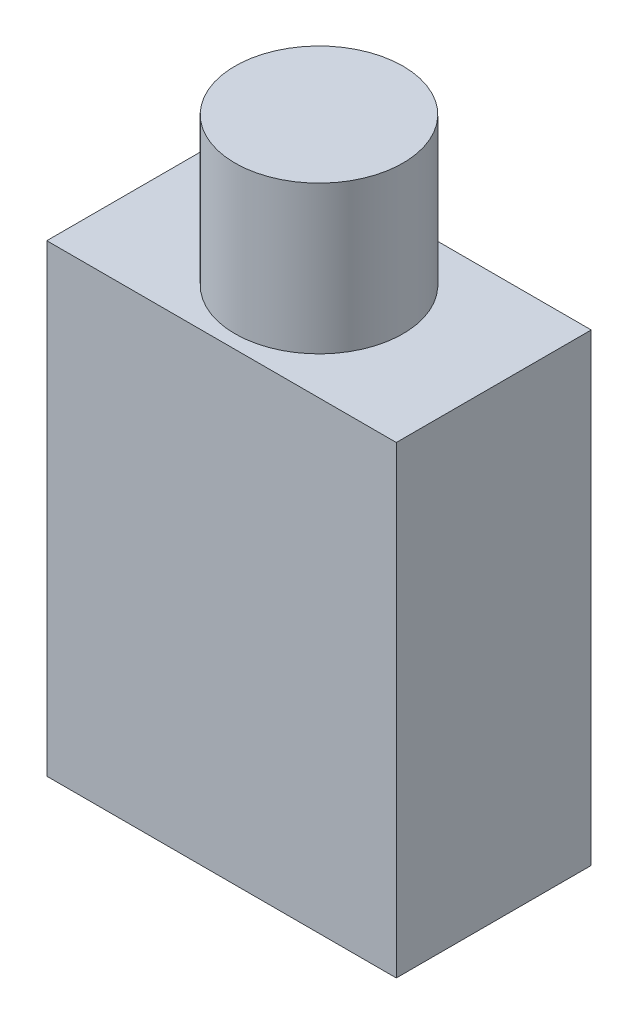
from build123d import *

# Parameters (mm, degrees)
SKETCH1_W           = 52
SKETCH1_H           = 69
BOSS_EXTRUDE1_DEPTH = 29
SKETCH2_R           = 12.5
BOSS_EXTRUDE2_DEPTH = 22


with BuildPart() as part:
    # Sketch1 → Boss-Extrude1 (new body)
    with BuildSketch(Plane.XY):
        with Locations((26, -34.5)):
            Rectangle(SKETCH1_W, SKETCH1_H)
    extrude(amount=BOSS_EXTRUDE1_DEPTH)

    # Sketch2 → Boss-Extrude2 (add)
    with BuildSketch(Plane(origin=(0, 0, 0), x_dir=(1, 0, 0), z_dir=(0, 1, 0))):
        with Locations(Location((26, -14.5, 0), (0, 0, 90))):
            Circle(SKETCH2_R)
    extrude(amount=BOSS_EXTRUDE2_DEPTH)


solid = part.part
